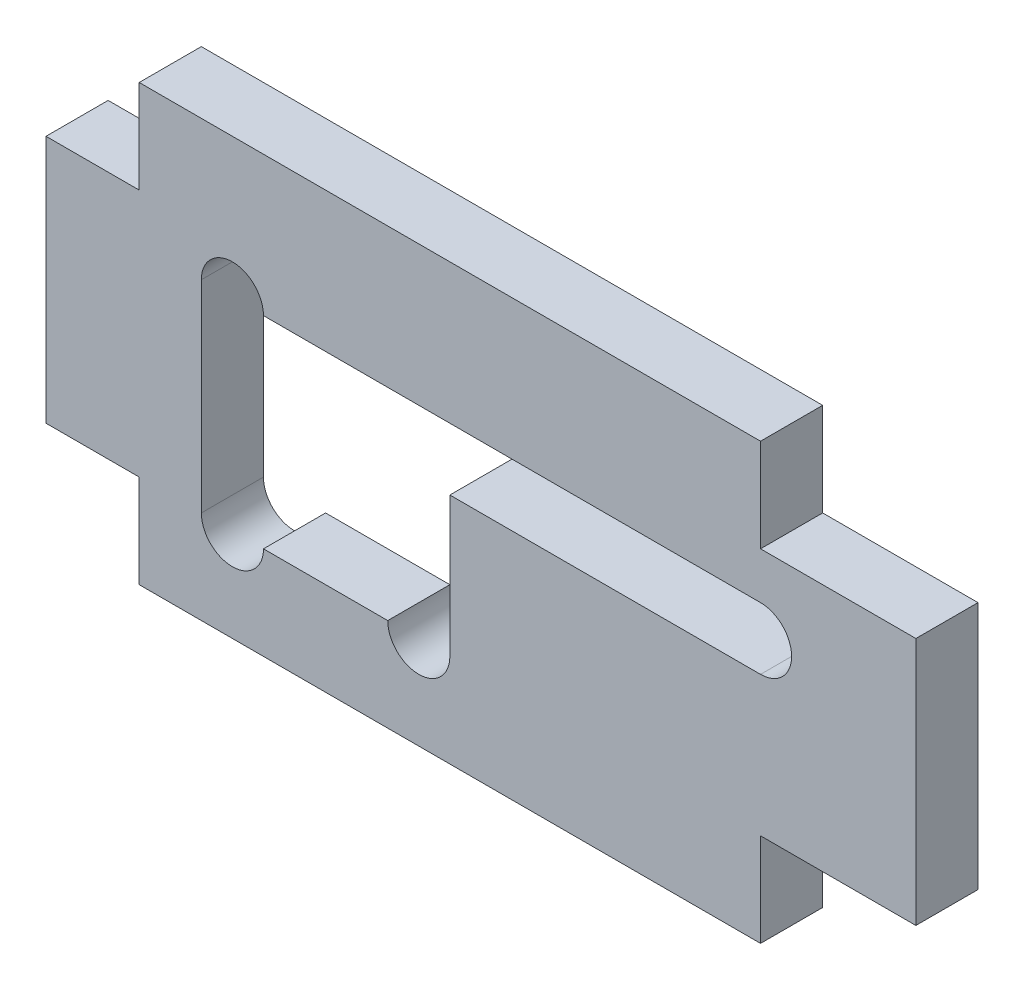
from build123d import *

# Parameters (mm, degrees)
BOSS_EXTRUDE1_DEPTH = 2
SKETCH3_W           = 5
SKETCH3_H           = 8
CUT_EXTRUDE1_DEPTH  = 2


with BuildPart() as part:
    # Sketch2 → Boss-Extrude1 (new body)
    with BuildSketch(Plane.XY):
        Polygon((-100.485199734, 17.220891199), (-80.485199734, 17.220891199), (-80.485199734, 14.220891199), (-70.485199734, 14.220891199), (-70.485199734, 6.220891199), (-80.485199734, 6.220891199), (-80.485199734, 3.220891199), (-100.485199734, 3.220891199), (-100.485199734, 6.220891199), (-103.485199734, 6.220891199), (-103.485199734, 14.220891199), (-100.485199734, 14.220891199), align=None)
        with BuildLine():
            Line((-90.485199734, 10.720891199), (-80.485199734, 10.720891199))
            ThreePointArc((-80.485199734, 10.720891199), (-79.485199734, 11.720891199), (-80.485199734, 12.720891199))
            Line((-80.485199734, 12.720891199), (-96.485199734, 12.720891199))
            ThreePointArc((-96.485199734, 12.720891199), (-97.485199734, 13.720891199), (-98.485199734, 12.720891199))
            Line((-98.485199734, 12.720891199), (-98.485199734, 6.220891199))
            ThreePointArc((-98.485199734, 6.220891199), (-97.485199734, 5.220891199), (-96.485199734, 6.220891199))
            Line((-96.485199734, 6.220891199), (-92.485199734, 6.220891199))
            ThreePointArc((-92.485199734, 6.220891199), (-91.485199734, 5.220891199), (-90.485199734, 6.220891199))
            Line((-90.485199734, 6.220891199), (-90.485199734, 10.720891199))
        make_face(mode=Mode.SUBTRACT)
    extrude(amount=BOSS_EXTRUDE1_DEPTH)

    # Sketch3 → Cut-Extrude1 (cut)
    with BuildSketch(Plane.XY.offset(2)):
        with Locations((-72.985199734, 10.220891199)):
            Rectangle(SKETCH3_W, SKETCH3_H)
    extrude(amount=-CUT_EXTRUDE1_DEPTH, mode=Mode.SUBTRACT)


solid = part.part
